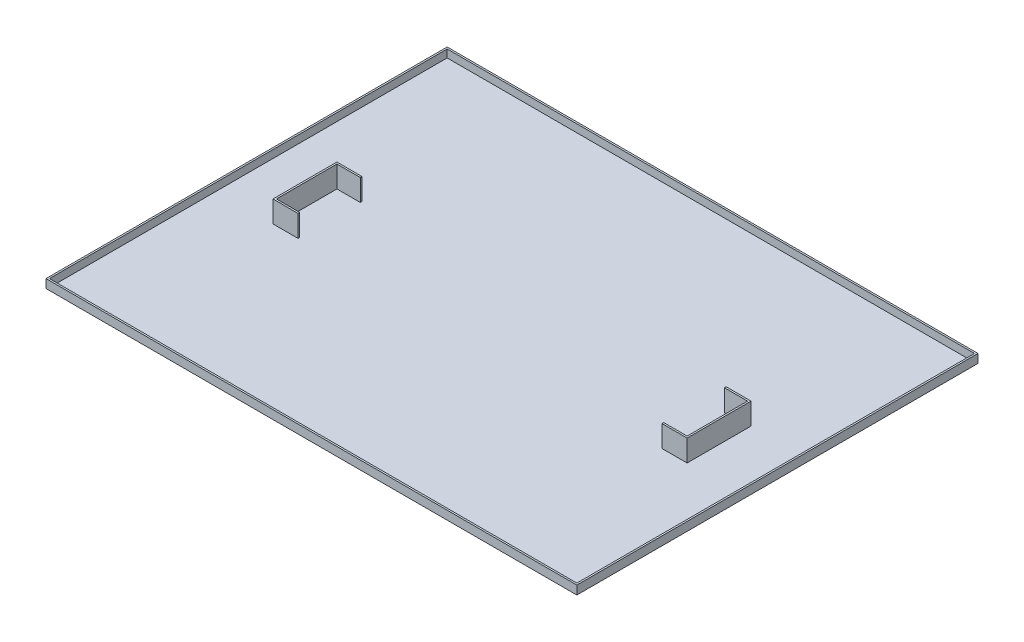
from build123d import *

# Parameters (mm, degrees)
SKETCH1_W           = 6140
SKETCH1_H           = 4640
SKETCH1_W_2         = 6100
SKETCH1_H_2         = 4600
BOSS_EXTRUDE1_DEPTH = 100
SKETCH1_2_W         = 6100
SKETCH1_2_H         = 4600
BOSS_EXTRUDE2_DEPTH = 10
BOSS_EXTRUDE3_DEPTH = 250


with BuildPart() as part:
    # Sketch1 → Boss-Extrude1 (new body)
    with BuildSketch(Plane(origin=(0, 0, 0), x_dir=(1, 0, 0), z_dir=(0, 1, 0))):
        Rectangle(SKETCH1_W, SKETCH1_H)
        Rectangle(SKETCH1_W_2, SKETCH1_H_2, mode=Mode.SUBTRACT)
    extrude(amount=BOSS_EXTRUDE1_DEPTH)

    # Sketch1<2> → Boss-Extrude2 (add)
    with BuildSketch(Plane(origin=(0, 0, 0), x_dir=(1, 0, 0), z_dir=(0, 1, 0))):
        Rectangle(SKETCH1_2_W, SKETCH1_2_H)
    extrude(amount=BOSS_EXTRUDE2_DEPTH)

    # Sketch2 → Boss-Extrude3 (add)
    with BuildSketch(Plane(origin=(0, 10, 0), x_dir=(1, 0, 0), z_dir=(0, 1, 0))):
        Polygon((-2395, 370), (-2105, 370), (-2105, 350), (-2125, 350), (-2375, 350), (-2375, -350), (-2125, -350), (-2105, -350), (-2105, -370), (-2395, -370), align=None)
    boss_extrude3 = extrude(amount=BOSS_EXTRUDE3_DEPTH)

    # Mirror1: Boss-Extrude3 across plane
    add(boss_extrude3.mirror(Plane(origin=(0, 0, 0), x_dir=(0, 0, 1), z_dir=(1, 0, 0))))


solid = part.part
